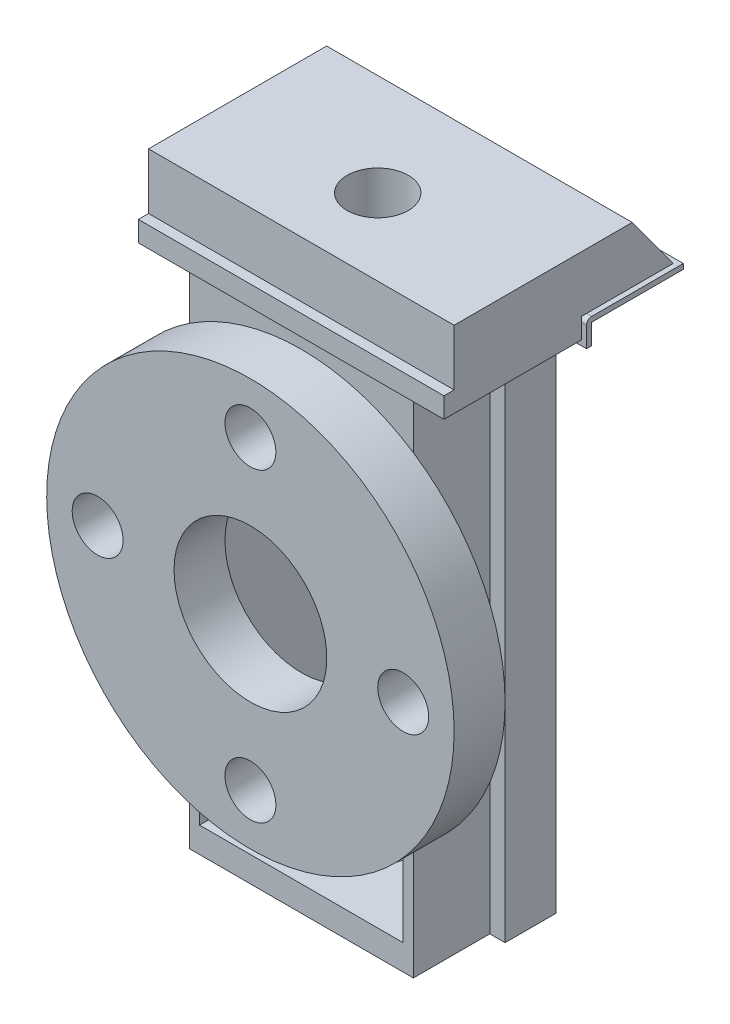
from build123d import *

# Parameters (mm, degrees)
SKETCH_1_W               = 50
SKETCH_1_H               = 100
SKETCH_1_W_2             = 40
SKETCH_1_H_2             = 90
EXTRUDE_1_DEPTH          = 25
CUT_EXTRUDE_1_DEPTH      = 100
CUT_EXTRUDE_1_DEPTH_BACK = 100
SKETCH_2_W               = 3
SKETCH_2_H               = 15
EXTRUDE_2_DEPTH          = 15
SKETCH_7_W               = 2
SKETCH_7_H               = 11
CUT_EXTRUDE_2_DEPTH      = 103
CUT_EXTRUDE_3_DEPTH      = 103
CUT_EXTRUDE_4_DEPTH      = 103
EXTRUDE_4_DEPTH          = 62
CUT_EXTRUDE_5_DEPTH      = 30
CUT_EXTRUDE_5_DEPTH_BACK = 123
SKETCH_15_R              = 6
SKETCH_16_R              = 3
CUT_EXTRUDE_6_DEPTH      = 4
SKETCH_18_W              = 40
SKETCH_18_H              = 14.629062191
EXTRUDE_5_DEPTH          = 5
SKETCH_19_R              = 40
SKETCH_19_R_2            = 5
EXTRUDE_7_DEPTH          = 10
SKETCH_19_8_R            = 15
CUT_EXTRUDE_8_DEPTH      = 25


with BuildPart() as part:
    # 草图1 → 凸台-拉伸1 (new body)
    with BuildSketch(Plane.XY):
        Rectangle(SKETCH_1_W, SKETCH_1_H)
        Rectangle(SKETCH_1_W_2, SKETCH_1_H_2, mode=Mode.SUBTRACT)
    extrude(amount=EXTRUDE_1_DEPTH)

    # 草图2 → 切除-拉伸1 (cut, two sides: drawn at the far end of the back side and taken through both)
    with BuildSketch(Plane(origin=(0, 0, 0), x_dir=(1, 0, 0), z_dir=(0, 1, 0)).offset(-CUT_EXTRUDE_1_DEPTH_BACK)):
        with Locations((23.5, -17.5)):
            Rectangle(SKETCH_2_W, SKETCH_2_H)
        with Locations((-23.5, -17.5)):
            Rectangle(SKETCH_2_W, SKETCH_2_H)
    extrude(amount=CUT_EXTRUDE_1_DEPTH + CUT_EXTRUDE_1_DEPTH_BACK, mode=Mode.SUBTRACT)

    # 草图5 → 凸台-拉伸2 (add)
    with BuildSketch(Plane(origin=(0, 50, 0), x_dir=(1, 0, 0), z_dir=(0, 1, 0))):
        Polygon((30, 18), (-20.718865569, 18), (-30, 18), (-30, -27), (30, -27), align=None)
    extrude(amount=EXTRUDE_2_DEPTH)

    # 草图7 → 切除-拉伸2 (cut)
    with BuildSketch(Plane.ZY.offset(30)):
        with Locations((26, 59.5)):
            Rectangle(SKETCH_7_W, SKETCH_7_H)
    extrude(amount=-CUT_EXTRUDE_2_DEPTH, mode=Mode.SUBTRACT)

    # 草图12 → 切除-拉伸3 (cut)
    with BuildSketch(Plane.ZY.offset(30)):
        Polygon((-9.968923852, 65), (-18, 65), (-18, 54), align=None)
    extrude(amount=-CUT_EXTRUDE_3_DEPTH, mode=Mode.SUBTRACT)

    # 草图13 → 切除-拉伸4 (cut)
    with BuildSketch(Plane.ZY.offset(30)):
        Polygon((0, 50), (0, 54), (-18, 54), (-18, 49.192005068), (0, 49.192005068), align=None)
    extrude(amount=-CUT_EXTRUDE_4_DEPTH, mode=Mode.SUBTRACT)

    # 草图14 → 凸台-拉伸4 (add)
    with BuildSketch(Plane.ZY.offset(31)):
        with BuildLine():
            Line((-1, 49), (0, 49))
            Line((0, 49), (0, 53))
            ThreePointArc((0, 53), (-0.292893219, 53.707106781), (-1, 54))
            Line((-1, 54), (-19, 54))
            Line((-19, 54), (-19, 53))
            Line((-19, 53), (-1, 53))
            Line((-1, 53), (-1, 49))
        make_face()
    extrude(amount=-EXTRUDE_4_DEPTH)

    # 草图15 → 切除-拉伸5 (cut, two sides: drawn at the far end of the back side and taken through both)
    with BuildSketch(Plane(origin=(0, 50, 0), x_dir=(1, 0, 0), z_dir=(0, 1, 0)).offset(-CUT_EXTRUDE_5_DEPTH_BACK)):
        with Locations((0, -10)):
            Circle(SKETCH_15_R)
    extrude(amount=CUT_EXTRUDE_5_DEPTH + CUT_EXTRUDE_5_DEPTH_BACK, mode=Mode.SUBTRACT)

    # 草图16 → 切除-拉伸6 (cut)
    with BuildSketch(Plane.XZ.offset(-53)):
        with Locations((15, -10)):
            Circle(SKETCH_16_R)
        with Locations((-15, -10)):
            Circle(SKETCH_16_R)
    extrude(amount=-CUT_EXTRUDE_6_DEPTH, mode=Mode.SUBTRACT)

    # 草图18 → 凸台-拉伸5 (add)
    with BuildSketch(Plane.XY.offset(25)):
        with Locations((0, 37.685468904)):
            Rectangle(SKETCH_18_W, SKETCH_18_H)
    extrude(amount=-EXTRUDE_5_DEPTH)

    # 草图19 → 凸台-拉伸7 (add)
    with BuildSketch(Plane.XY.offset(25)):
        with Locations((0, 5.916189744)):
            Circle(SKETCH_19_R)
        with BuildLine():
            ThreePointArc((0, 40.916189744), (5, 35.916189744), (0, 30.916189744))
            ThreePointArc((0, 30.916189744), (-5, 35.916189744), (0, 40.916189744))
        make_face(mode=Mode.SUBTRACT)
        with Locations((-30, 5.916189744)):
            Circle(SKETCH_19_R_2, mode=Mode.SUBTRACT)
        with Locations((0, -24.083810256)):
            Circle(SKETCH_19_R_2, mode=Mode.SUBTRACT)
        with Locations((30, 5.916189744)):
            Circle(SKETCH_19_R_2, mode=Mode.SUBTRACT)
    extrude(amount=EXTRUDE_7_DEPTH)

    # 草图19<8> → 切除-拉伸8 (cut)
    with BuildSketch(Plane.XY.offset(25)):
        with Locations((0, 5.916189744)):
            Circle(SKETCH_19_8_R)
    extrude(amount=CUT_EXTRUDE_8_DEPTH, mode=Mode.SUBTRACT)


solid = part.part
